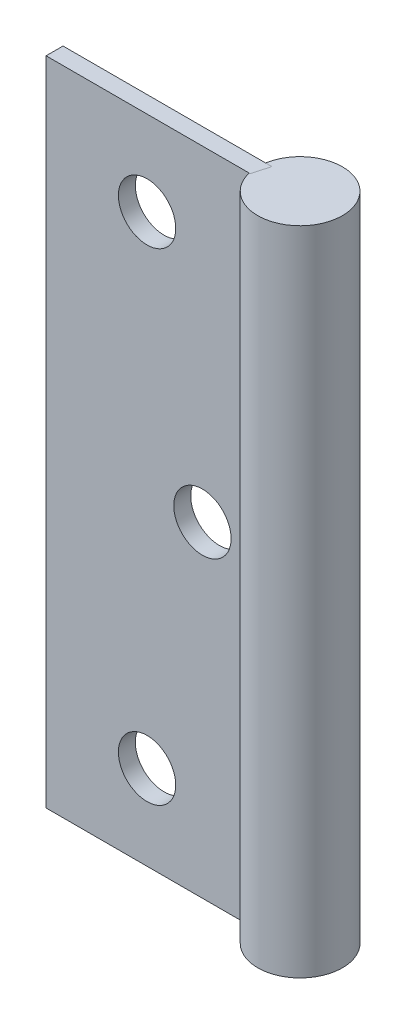
from build123d import *

# Parameters (mm, degrees)
SKETCH_1_W          = 16
SKETCH_1_H          = 50
EXTRUDE_1_DEPTH     = 1.3
SKETCH_2_R          = 2.2
CUT_EXTRUDE_1_DEPTH = 2
SKETCH_3_R          = 3.25
EXTRUDE_2_DEPTH     = 50


with BuildPart() as part:
    # 草图1 → 凸台-拉伸1 (new body)
    with BuildSketch(Plane.XY):
        Rectangle(SKETCH_1_W, SKETCH_1_H)
    extrude(amount=EXTRUDE_1_DEPTH)

    # 草图2 → 切除-拉伸1 (cut)
    with BuildSketch(Plane.XY.offset(1.3)):
        with Locations((4, 0)):
            Circle(SKETCH_2_R)
        with Locations((-0.25, 18.5)):
            Circle(SKETCH_2_R)
        with Locations((-0.25, -18.5)):
            Circle(SKETCH_2_R)
    extrude(amount=-CUT_EXTRUDE_1_DEPTH, mode=Mode.SUBTRACT)


with BuildPart() as body_2:
    # 草图3 → 凸台-拉伸2 (new body)
    with BuildSketch(Plane.XZ.offset(25)):
        with Locations(Location((10.75, 0.553753861, 0), (0, 0, 270))):
            Circle(SKETCH_3_R)
    extrude(amount=-EXTRUDE_2_DEPTH)


solid = Compound([part.part, body_2.part])
